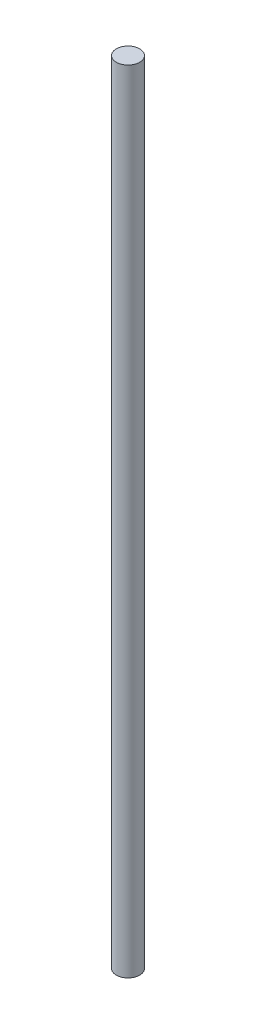
from build123d import *

# Parameters (mm, degrees)
SKETCH1_R           = 3.25
BOSS_EXTRUDE1_DEPTH = 220


with BuildPart() as part:
    # Sketch1 → Boss-Extrude1 (new body)
    with BuildSketch(Plane(origin=(0, 0, 0), x_dir=(1, 0, 0), z_dir=(0, 1, 0))):
        with Locations(Location((4.781043184, -5.252856656, 0), (0, 0, 270))):
            Circle(SKETCH1_R)
    extrude(amount=BOSS_EXTRUDE1_DEPTH)


solid = part.part
